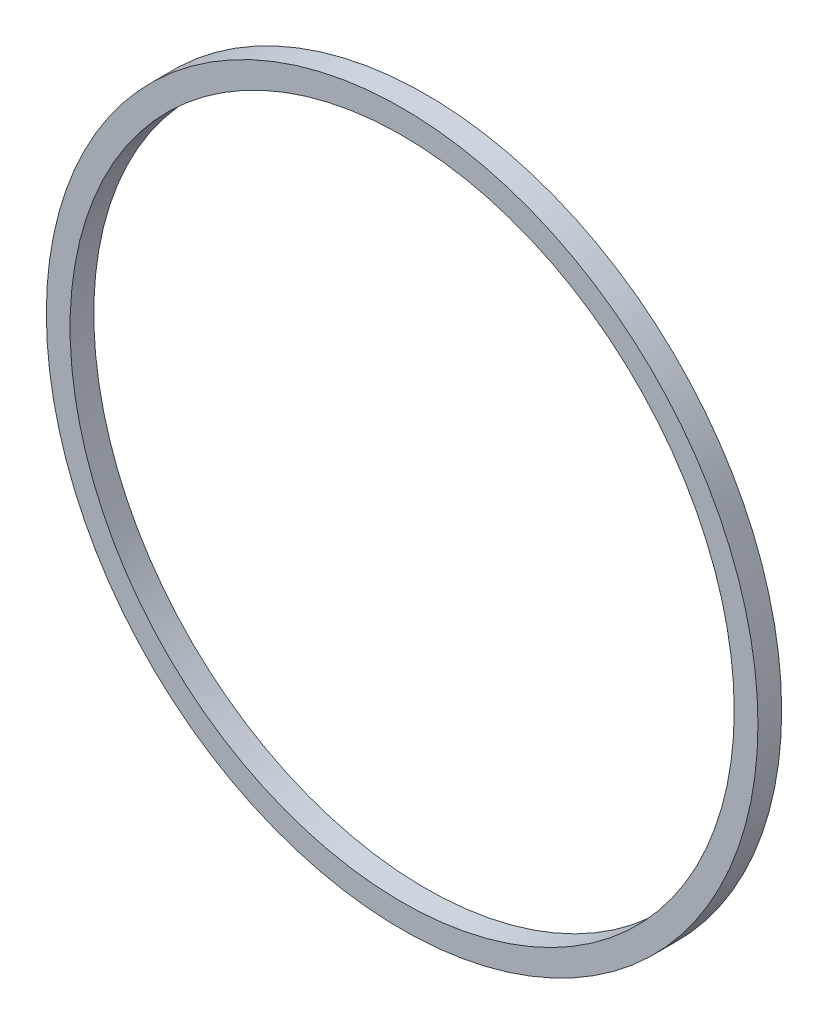
from build123d import *

# Parameters (mm, degrees)
SKETCH_1_R      = 30
SKETCH_1_R_2    = 28
EXTRUDE_1_DEPTH = 2


with BuildPart() as part:
    # 草图1 → 凸台-拉伸1 (new body)
    with BuildSketch(Plane.XY):
        Circle(SKETCH_1_R)
        Circle(SKETCH_1_R_2, mode=Mode.SUBTRACT)
    extrude(amount=EXTRUDE_1_DEPTH)


solid = part.part
